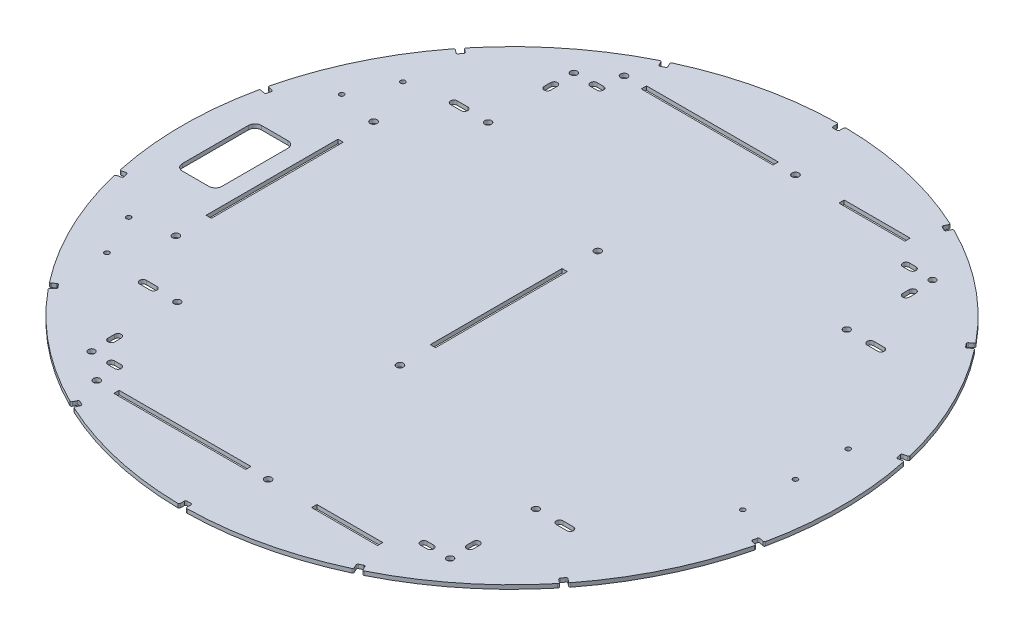
from build123d import *

# Parameters (mm, degrees)
SKETCH1_R                = 250
BOSS_EXTRUDE1_DEPTH      = 3
CUT_EXTRUDE5_DEPTH       = 4
FILLET1_R                = 1
CIRPATTERN1_COUNT        = 14
FILLET1_OF_CIRPATTERN1_R = 1
SKETCH17_W               = 4
SKETCH17_H               = 100
CUT_EXTRUDE11_DEPTH      = 10
SKETCH18_R               = 2.6
CUT_EXTRUDE12_DEPTH      = 10
CUT_EXTRUDE14_DEPTH      = 14
SKETCH21_R               = 2.6
SKETCH21_W               = 100
SKETCH21_H               = 4
CUT_EXTRUDE15_DEPTH      = 14
SKETCH22_R               = 2.5
CUT_EXTRUDE16_DEPTH      = 14
CUT_EXTRUDE17_DEPTH      = 14
SKETCH25_W               = 50
SKETCH25_H               = 4
CUT_EXTRUDE18_DEPTH      = 4
CUT_EXTRUDE19_DEPTH      = 4
SKETCH27_R               = 1.8
CUT_EXTRUDE20_DEPTH      = 10
SKETCH28_R               = 1.8
CUT_EXTRUDE21_DEPTH      = 10


with BuildPart() as part:
    # Sketch1 → Boss-Extrude1 (new body)
    with BuildSketch(Plane(origin=(0, 0, 0), x_dir=(1, 0, 0), z_dir=(0, 1, 0))):
        with Locations(Location((0, 0, 0), (0, 0, 270))):
            Circle(SKETCH1_R)
    extrude(amount=BOSS_EXTRUDE1_DEPTH)

    # Sketch11 → Cut-Extrude5 (cut)
    with BuildSketch(Plane(origin=(0, 3, 0), x_dir=(1, 0, 0), z_dir=(0, 1, 0))):
        with BuildLine():
            Line((1.5, 245), (-1.5, 245))
            ThreePointArc((-1.5, 245), (-2.207106781, 245.292893219), (-2.5, 246))
            Line((-2.5, 246), (-2.5, 255))
            Line((-2.5, 255), (2.5, 255))
            Line((2.5, 255), (2.5, 246))
            ThreePointArc((2.5, 246), (2.207106781, 245.292893219), (1.5, 245))
        make_face()
    cut_extrude5 = extrude(amount=-CUT_EXTRUDE5_DEPTH, mode=Mode.SUBTRACT)

    # Fillet1
    fillet1_edges = [part.edges().sort_by_distance(p)[0] for p in [
        (-2.5, 1.5, -249.987499687),
        (2.5, 1.5, -249.987499687),
    ]]
    fillet(fillet1_edges, radius=FILLET1_R)

    # CirPattern1: Cut-Extrude5 ×14 about axis
    cirpattern1_axis = Axis((0, 0, 0), (0, 1, 0))
    for i in range(1, CIRPATTERN1_COUNT):
        add(cut_extrude5.rotate(cirpattern1_axis, i * 360 / CIRPATTERN1_COUNT), mode=Mode.SUBTRACT)

    # Fillet1 of CirPattern1
    fillet1_of_cirpattern1_edges = [part.edges().sort_by_distance(p)[0] for p in [
        (-110.717933267, 1.5, -224.146245235),
        (-106.213088927, 1.5, -226.315663931),
        (-197.006821984, 1.5, -153.910077941),
        (-193.889372974, 1.5, -157.819235353),
        (-244.276093477, 1.5, -53.190132127),
        (-243.163488807, 1.5, -58.064771688),
        (-243.163488807, 1.5, 58.064771688),
        (-244.276093477, 1.5, 53.190132127),
        (-193.889372974, 1.5, 157.819235353),
        (-197.006821984, 1.5, 153.910077941),
        (-106.213088927, 1.5, 226.315663931),
        (-110.717933267, 1.5, 224.146245235),
        (2.5, 1.5, 249.987499687),
        (-2.5, 1.5, 249.987499687),
        (110.717933267, 1.5, 224.146245235),
        (106.213088927, 1.5, 226.315663931),
        (197.006821984, 1.5, 153.910077941),
        (193.889372974, 1.5, 157.819235353),
        (244.276093477, 1.5, 53.190132127),
        (243.163488807, 1.5, 58.064771688),
        (243.163488807, 1.5, -58.064771688),
        (244.276093477, 1.5, -53.190132127),
        (193.889372974, 1.5, -157.819235353),
        (197.006821984, 1.5, -153.910077941),
        (106.213088927, 1.5, -226.315663931),
        (110.717933267, 1.5, -224.146245235),
    ]]
    fillet(fillet1_of_cirpattern1_edges, radius=FILLET1_OF_CIRPATTERN1_R)

    # Sketch17 → Cut-Extrude11 (cut)
    with BuildSketch(Plane(origin=(0, 3, 0), x_dir=(1, 0, 0), z_dir=(0, 1, 0))):
        with Locations((-10, 0)):
            Rectangle(SKETCH17_W, SKETCH17_H)
        with Locations((-180, 0)):
            Rectangle(SKETCH17_W, SKETCH17_H)
    extrude(amount=-CUT_EXTRUDE11_DEPTH, mode=Mode.SUBTRACT)

    # Sketch18 → Cut-Extrude12 (cut)
    with BuildSketch(Plane(origin=(0, 3, 0), x_dir=(1, 0, 0), z_dir=(0, 1, 0))):
        with Locations(Location((-180, 75, 0), (0, 0, 270))):
            Circle(SKETCH18_R)
        with Locations(Location((-180, -75, 0), (0, 0, 270))):
            Circle(SKETCH18_R)
        with Locations(Location((-10, 75, 0), (0, 0, 270))):
            Circle(SKETCH18_R)
        with Locations(Location((-10, -75, 0), (0, 0, 270))):
            Circle(SKETCH18_R)
    extrude(amount=-CUT_EXTRUDE12_DEPTH, mode=Mode.SUBTRACT)

    # Sketch20 → Cut-Extrude14 (cut)
    with BuildSketch(Plane.XZ):
        with BuildLine():
            Line((-162, -115.4), (-154, -115.4))
            ThreePointArc((-154, -115.4), (-151.5, -117.9), (-154, -120.4))
            Line((-154, -120.4), (-162, -120.4))
            ThreePointArc((-162, -120.4), (-164.5, -117.9), (-162, -115.4))
        make_face()
        with BuildLine():
            Line((162, -115.4), (154, -115.4))
            ThreePointArc((154, -115.4), (151.5, -117.9), (154, -120.4))
            Line((154, -120.4), (162, -120.4))
            ThreePointArc((162, -120.4), (164.5, -117.9), (162, -115.4))
        make_face()
        with BuildLine():
            Line((162, 115.4), (154, 115.4))
            ThreePointArc((154, 115.4), (151.5, 117.9), (154, 120.4))
            Line((154, 120.4), (162, 120.4))
            ThreePointArc((162, 120.4), (164.5, 117.9), (162, 115.4))
        make_face()
        with BuildLine():
            Line((-162, 115.4), (-154, 115.4))
            ThreePointArc((-154, 115.4), (-151.5, 117.9), (-154, 120.4))
            Line((-154, 120.4), (-162, 120.4))
            ThreePointArc((-162, 120.4), (-164.5, 117.9), (-162, 115.4))
        make_face()
    extrude(amount=-CUT_EXTRUDE14_DEPTH, mode=Mode.SUBTRACT)

    # Sketch21 → Cut-Extrude15 (cut)
    with BuildSketch(Plane(origin=(0, 3, 0), x_dir=(1, 0, 0), z_dir=(0, 1, 0))):
        with Locations(Location((-115, 200, 0), (0, 0, 270))):
            Circle(SKETCH21_R)
        with Locations(Location((15, 200, 0), (0, 0, 270))):
            Circle(SKETCH21_R)
        with Locations(Location((15, -200, 0), (0, 0, 270))):
            Circle(SKETCH21_R)
        with Locations(Location((-115, -200, 0), (0, 0, 270))):
            Circle(SKETCH21_R)
        with Locations((-50, 200)):
            Rectangle(SKETCH21_W, SKETCH21_H)
        with Locations((-50, -200)):
            Rectangle(SKETCH21_W, SKETCH21_H)
    extrude(amount=-CUT_EXTRUDE15_DEPTH, mode=Mode.SUBTRACT)

    # Sketch22 → Cut-Extrude16 (cut)
    with BuildSketch(Plane(origin=(0, 3, 0), x_dir=(1, 0, 0), z_dir=(0, 1, 0))):
        with Locations(Location((-136, -117.9, 0), (0, 0, 270))):
            Circle(SKETCH22_R)
        with Locations(Location((-136, 117.9, 0), (0, 0, 270))):
            Circle(SKETCH22_R)
        with Locations(Location((136, 117.9, 0), (0, 0, 270))):
            Circle(SKETCH22_R)
        with Locations(Location((136, -117.9, 0), (0, 0, 270))):
            Circle(SKETCH22_R)
        with Locations(Location((-136, 182.9, 0), (0, 0, 270))):
            Circle(SKETCH22_R)
        with Locations(Location((136, 182.9, 0), (0, 0, 270))):
            Circle(SKETCH22_R)
        with Locations(Location((-136, -182.9, 0), (0, 0, 270))):
            Circle(SKETCH22_R)
        with Locations(Location((136, -182.9, 0), (0, 0, 270))):
            Circle(SKETCH22_R)
    extrude(amount=-CUT_EXTRUDE16_DEPTH, mode=Mode.SUBTRACT)

    # Sketch24 → Cut-Extrude17 (cut)
    with BuildSketch(Plane.XZ):
        with BuildLine():
            Line((-200, -30), (-220, -30))
            ThreePointArc((-220, -30), (-223.535533906, -28.535533906), (-225, -25))
            Line((-225, -25), (-225, 25))
            ThreePointArc((-225, 25), (-223.535533906, 28.535533906), (-220, 30))
            Line((-220, 30), (-200, 30))
            ThreePointArc((-200, 30), (-196.464466094, 28.535533906), (-195, 25))
            Line((-195, 25), (-195, -25))
            ThreePointArc((-195, -25), (-196.464466094, -28.535533906), (-200, -30))
        make_face()
    extrude(amount=-CUT_EXTRUDE17_DEPTH, mode=Mode.SUBTRACT)

    # Sketch25 → Cut-Extrude18 (cut)
    with BuildSketch(Plane(origin=(0, 3, 0), x_dir=(1, 0, 0), z_dir=(0, 1, 0))):
        with Locations((75, 200)):
            Rectangle(SKETCH25_W, SKETCH25_H)
        with Locations((75, -200)):
            Rectangle(SKETCH25_W, SKETCH25_H)
    extrude(amount=-CUT_EXTRUDE18_DEPTH, mode=Mode.SUBTRACT)

    # Sketch26 → Cut-Extrude19 (cut)
    with BuildSketch(Plane(origin=(0, 3, 0), x_dir=(1, 0, 0), z_dir=(0, 1, 0))):
        with BuildLine():
            Line((-138.5, 162.9), (-138.5, 167.9))
            ThreePointArc((-138.5, 167.9), (-136, 170.4), (-133.5, 167.9))
            Line((-133.5, 167.9), (-133.5, 162.9))
            ThreePointArc((-133.5, 162.9), (-136, 160.4), (-138.5, 162.9))
        make_face()
        with BuildLine():
            Line((-116, 180.4), (-121, 180.4))
            ThreePointArc((-121, 180.4), (-123.5, 182.9), (-121, 185.4))
            Line((-121, 185.4), (-116, 185.4))
            ThreePointArc((-116, 185.4), (-113.5, 182.9), (-116, 180.4))
        make_face()
        with BuildLine():
            Line((116, 180.4), (121, 180.4))
            ThreePointArc((121, 180.4), (123.5, 182.9), (121, 185.4))
            Line((121, 185.4), (116, 185.4))
            ThreePointArc((116, 185.4), (113.5, 182.9), (116, 180.4))
        make_face()
        with BuildLine():
            Line((138.5, 162.9), (138.5, 167.9))
            ThreePointArc((138.5, 167.9), (136, 170.4), (133.5, 167.9))
            Line((133.5, 167.9), (133.5, 162.9))
            ThreePointArc((133.5, 162.9), (136, 160.4), (138.5, 162.9))
        make_face()
        with BuildLine():
            Line((116, -180.4), (121, -180.4))
            ThreePointArc((121, -180.4), (123.5, -182.9), (121, -185.4))
            Line((121, -185.4), (116, -185.4))
            ThreePointArc((116, -185.4), (113.5, -182.9), (116, -180.4))
        make_face()
        with BuildLine():
            Line((138.5, -162.9), (138.5, -167.9))
            ThreePointArc((138.5, -167.9), (136, -170.4), (133.5, -167.9))
            Line((133.5, -167.9), (133.5, -162.9))
            ThreePointArc((133.5, -162.9), (136, -160.4), (138.5, -162.9))
        make_face()
        with BuildLine():
            Line((-138.5, -162.9), (-138.5, -167.9))
            ThreePointArc((-138.5, -167.9), (-136, -170.4), (-133.5, -167.9))
            Line((-133.5, -167.9), (-133.5, -162.9))
            ThreePointArc((-133.5, -162.9), (-136, -160.4), (-138.5, -162.9))
        make_face()
        with BuildLine():
            Line((-116, -180.4), (-121, -180.4))
            ThreePointArc((-121, -180.4), (-123.5, -182.9), (-121, -185.4))
            Line((-121, -185.4), (-116, -185.4))
            ThreePointArc((-116, -185.4), (-113.5, -182.9), (-116, -180.4))
        make_face()
    extrude(amount=-CUT_EXTRUDE19_DEPTH, mode=Mode.SUBTRACT)

    # Sketch27 → Cut-Extrude20 (cut)
    with BuildSketch(Plane(origin=(0, 3, 0), x_dir=(1, 0, 0), z_dir=(0, 1, 0))):
        with Locations(Location((215, 0, 0), (0, 0, 270))):
            Circle(SKETCH27_R)
        with Locations(Location((215, 40, 0), (0, 0, 270))):
            Circle(SKETCH27_R)
        with Locations(Location((215, -40, 0), (0, 0, 270))):
            Circle(SKETCH27_R)
    extrude(amount=-CUT_EXTRUDE20_DEPTH, mode=Mode.SUBTRACT)

    # Sketch28 → Cut-Extrude21 (cut)
    with BuildSketch(Plane(origin=(0, 3, 0), x_dir=(1, 0, 0), z_dir=(0, 1, 0))):
        with Locations(Location((-210, 80.777472107, 0), (0, 0, 270))):
            Circle(SKETCH28_R)
        with Locations(Location((-195, 112.249721603, 0), (0, 0, 270))):
            Circle(SKETCH28_R)
        with Locations(Location((-195, -112.249721603, 0), (0, 0, 270))):
            Circle(SKETCH28_R)
        with Locations(Location((-210, -80.777472107, 0), (0, 0, 270))):
            Circle(SKETCH28_R)
    extrude(amount=-CUT_EXTRUDE21_DEPTH, mode=Mode.SUBTRACT)


solid = part.part
